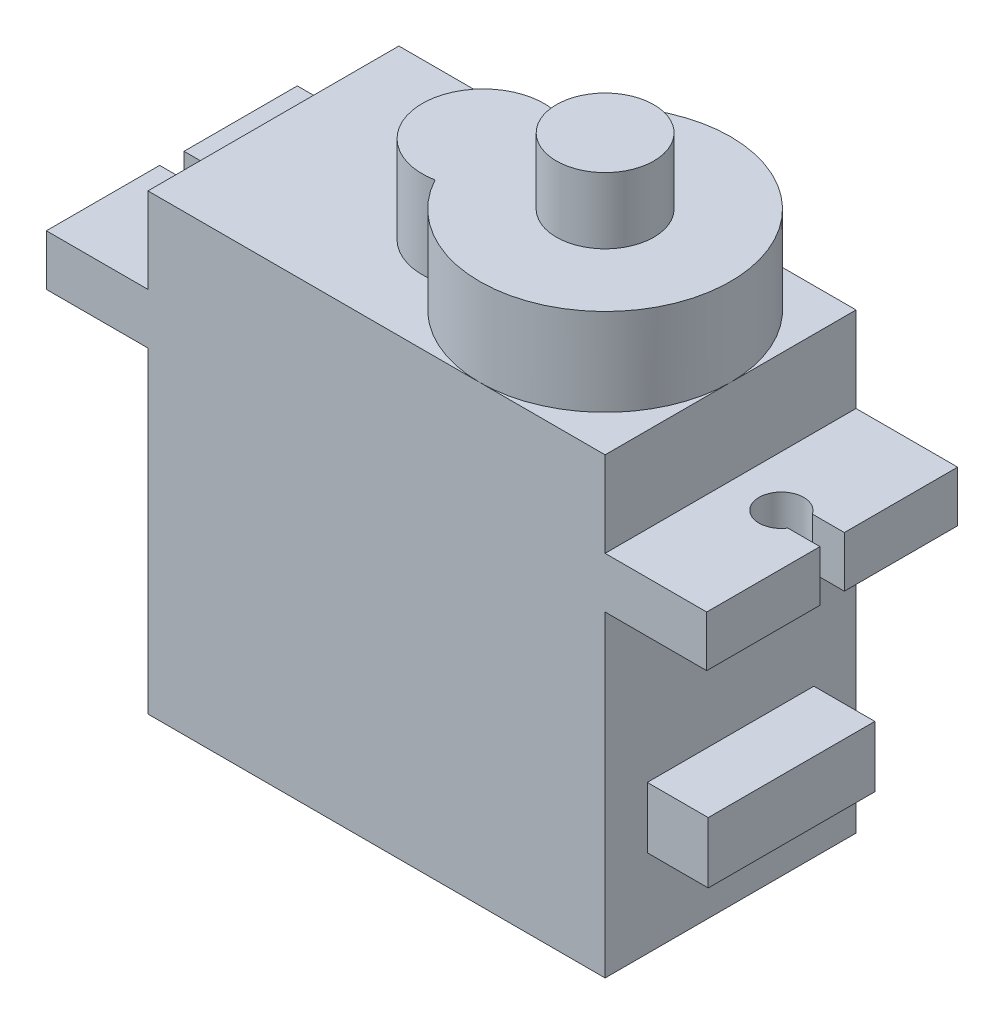
from build123d import *

# Parameters (mm, degrees)
BOSS_EXTRUDE1_DEPTH = 12.35
BOSS_EXTRUDE2_DEPTH = 4.3
SKETCH3_R           = 2.4
BOSS_EXTRUDE3_DEPTH = 3.25
SKETCH4_W           = 8.2
SKETCH4_H           = 3
BOSS_EXTRUDE4_DEPTH = 3
CUT_EXTRUDE1_DEPTH  = 3


with BuildPart() as part:
    # Sketch1 → Boss-Extrude1 (new body)
    with BuildSketch(Plane.XY):
        Polygon((0, 0), (22.5, 0), (22.5, 15.6), (27.5, 15.6), (27.5, 18.1), (22.5, 18.1), (22.5, 22.3), (0, 22.3), (0, 18.1), (-5, 18.1), (-5, 15.6), (0, 15.6), align=None)
    extrude(amount=BOSS_EXTRUDE1_DEPTH)

    # Sketch2 → Boss-Extrude2 (add)
    with BuildSketch(Plane(origin=(0, 22.3, 0), x_dir=(1, 0, 0), z_dir=(0, 1, 0))):
        with BuildLine():
            ThreePointArc((10.897447917, -9.119877482), (22.5, -6.175), (10.897447917, -3.230122518))
            ThreePointArc((10.897447917, -3.230122518), (7.325, -6.175), (10.897447917, -9.119877482))
        make_face()
    extrude(amount=BOSS_EXTRUDE2_DEPTH)

    # Sketch3 → Boss-Extrude3 (add)
    with BuildSketch(Plane(origin=(0, 26.6, 0), x_dir=(1, 0, 0), z_dir=(0, 1, 0))):
        with Locations((16.325, -6.175)):
            Circle(SKETCH3_R)
    extrude(amount=BOSS_EXTRUDE3_DEPTH)

    # Sketch4 → Boss-Extrude4 (add)
    with BuildSketch(Plane(origin=(22.5, 0, 0), x_dir=(0, 0, -1), z_dir=(1, 0, 0))):
        with Locations((-6.175, 5.8)):
            Rectangle(SKETCH4_W, SKETCH4_H)
    extrude(amount=BOSS_EXTRUDE4_DEPTH)

    # Sketch5 → Cut-Extrude1 (cut)
    with BuildSketch(Plane(origin=(0, 18.1, 0), x_dir=(1, 0, 0), z_dir=(0, 1, 0))):
        with BuildLine():
            Line((-3.421954446, -5.575), (-5, -5.575))
            Line((-5, -5.575), (-5, -6.775))
            Line((-5, -6.775), (-3.421954446, -6.775))
            ThreePointArc((-3.421954446, -6.775), (-1.4, -6.175), (-3.421954446, -5.575))
        make_face()
        with BuildLine():
            Line((25.921954446, -6.775), (27.5, -6.775))
            Line((27.5, -6.775), (27.5, -5.575))
            Line((27.5, -5.575), (25.921954446, -5.575))
            ThreePointArc((25.921954446, -5.575), (23.9, -6.175), (25.921954446, -6.775))
        make_face()
    extrude(amount=-CUT_EXTRUDE1_DEPTH, mode=Mode.SUBTRACT)


solid = part.part
